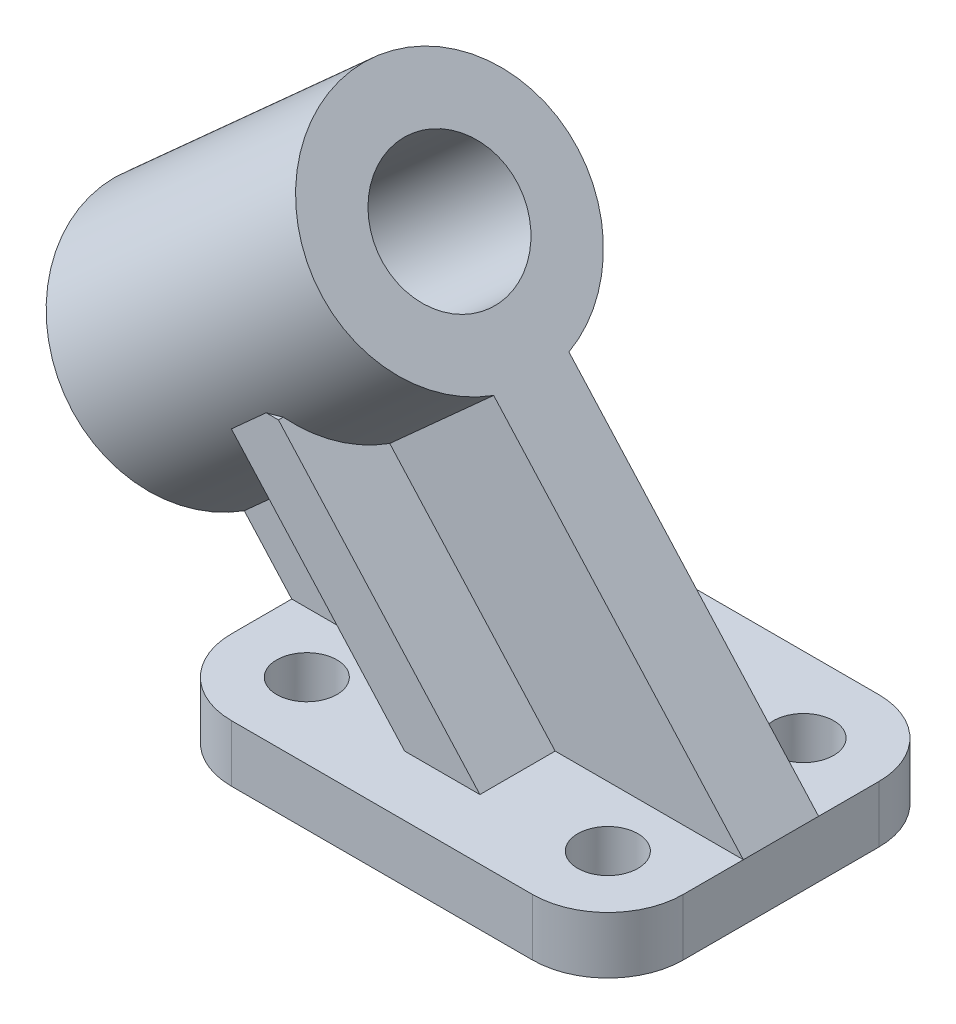
from build123d import *

# Parameters (mm, degrees)
SKETCH1_W                  = 60
SKETCH1_H                  = 46
BOSS_EXTRUDE1_DEPTH        = 7.55
FILLET1_R                  = 10
F_8_0_8_DIAMETER_HOLE1_D   = 8
SKETCH4_W                  = 60
SKETCH4_H                  = 10
BOSS_EXTRUDE2_DEPTH        = 64
CUT_EXTRUDE1_DEPTH         = 50
SKETCH7_4_R                = 17
BOSS_EXTRUDE3_DEPTH        = 44.58869
SKETCH11_W                 = 10
SKETCH11_H                 = 10
BOSS_EXTRUDE4_DEPTH        = 40
F_18_0_18_DIAMETER_HOLE1_D = 18


with BuildPart() as part:
    # Sketch1 → Boss-Extrude1 (new body)
    with BuildSketch(Plane(origin=(0, 0, 0), x_dir=(1, 0, 0), z_dir=(0, 1, 0))):
        with Locations((30, 23)):
            Rectangle(SKETCH1_W, SKETCH1_H)
    extrude(amount=BOSS_EXTRUDE1_DEPTH)

    # Fillet1
    fillet1_edges = [part.edges().sort_by_distance(p)[0] for p in [
        (0, 3.775, -46),
        (60, 3.775, -46),
        (60, 3.775, 0),
        (0, 3.775, 0),
    ]]
    fillet(fillet1_edges, radius=FILLET1_R)

    # Ø8.0 (8) Diameter Hole1 (through all)
    with Locations(Plane(origin=(50, 7.55, -10), x_dir=(0, 0, 1), z_dir=(0, 1, 0))):
        with Locations((0, 0), (0, -40), (-26, -40), (-26, 0)):
            Hole(F_8_0_8_DIAMETER_HOLE1_D / 2)

    # Sketch4 → Boss-Extrude2 (add, along a direction that is not the sketch's normal)
    with BuildSketch(Plane(origin=(0, 7.55, 0), x_dir=(1, 0, 0), z_dir=(0, 1, 0))):
        with Locations((30, 23)):
            Rectangle(SKETCH4_W, SKETCH4_H)
    extrude(amount=BOSS_EXTRUDE2_DEPTH, dir=(-0.6691306063588565, 0.7431448254773959, 0))

    # Sketch7 → Cut-Extrude1 (cut)
    with BuildSketch(Plane(origin=(36.890174053, 33.216061912, 0), x_dir=(0, 0, -1), z_dir=(0.7431448254773956, 0.6691306063588568, 0))):
        with BuildLine():
            Line((14.444935509, 45.97411464), (14.444935509, 31.283611873))
            Line((14.444935509, 31.283611873), (33.990304022, 31.283611873))
            Line((33.990304022, 31.283611873), (33.990304022, 44.253315706))
            ThreePointArc((33.990304022, 44.253315706), (24.490934317, 48.218106695), (14.444935509, 45.97411464))
        make_face()
    extrude(amount=-CUT_EXTRUDE1_DEPTH, mode=Mode.SUBTRACT)


with BuildPart() as cut_extrude1_kept_piece:
    # of the separate pieces the step leaves, the one the design keeps (cut_extrude1_pieces_kept)
    add(part.part.solids().sort_by_distance((10, 0, 0))[0])

    # Sketch7<4> → Boss-Extrude3 (add)
    with BuildSketch(Plane(origin=(36.890174053, 33.216061912, 0), x_dir=(0, 0, -1), z_dir=(0.7431448254773956, 0.6691306063588568, 0))):
        with Locations((23, 31.283611873)):
            Circle(SKETCH7_4_R)
    extrude(amount=-BOSS_EXTRUDE3_DEPTH)

    # Sketch11 → Boss-Extrude4 (add, along a direction that is not the sketch's normal)
    with BuildSketch(Plane(origin=(0, 7.55, 0), x_dir=(1, 0, 0), z_dir=(0, 1, 0))):
        with Locations((30, 33)):
            Rectangle(SKETCH11_W, SKETCH11_H)
        with Locations((30, 13)):
            Rectangle(SKETCH11_W, SKETCH11_H)
    extrude(amount=BOSS_EXTRUDE4_DEPTH, dir=(-0.6691306063588565, 0.7431448254773958, 0))

    # Ø18.0 (18) Diameter Hole1 (through all)
    with Locations(Plane(origin=(15.957351871, 56.464316198, -23), x_dir=(-0.669130606359, 0.743144825477, 0), z_dir=(0.743144825477, 0.669130606359, 0))):
        with Locations((0, 0)):
            Hole(F_18_0_18_DIAMETER_HOLE1_D / 2)


solid = cut_extrude1_kept_piece.part
